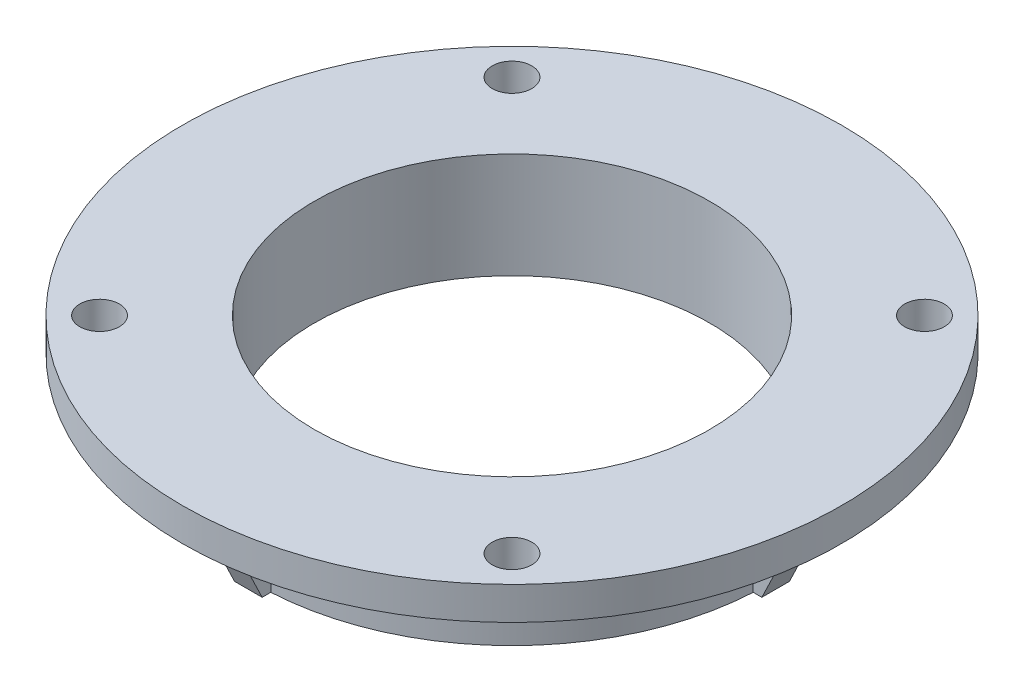
from build123d import *

# Parameters (mm, degrees)
IZIM1_R                          = 77.5
IZIM1_R_2                        = 60
IZIM1_R_3                        = 4.19
Y_KSEKLIK_EKSTR_ZYON1_DEPTH      = 10
IZIM2_R                          = 77.5
IZIM2_R_2                        = 60
Y_KSEKLIK_EKSTR_ZYON2_DEPTH      = 22
Y_KSEKLIK_EKSTR_ZYON3_START      = -10
IZIM3_R                          = 100
IZIM3_R_2                        = 60
Y_KSEKLIK_EKSTR_ZYON3_DEPTH      = 10
Y_KSEKLIK_EKSTR_ZYON4_REACH      = 210.384
Y_KSEKLIK_EKSTR_ZYON4_END_RADIUS = 77.5
IZIM5_W                          = 8.38
IZIM5_H                          = 22
DAIRESEL_KAPLAMA1_COUNT          = 4
EKSTR_ZYON_NCE4_DEPTH            = 4.19
DAIRESEL_KAPLAMA2_COUNT          = 4
IZIM7_R                          = 4.19
KES_EKSTR_ZYON1_DEPTH            = 10
IZIM8_R                          = 6
KES_EKSTR_ZYON2_DEPTH            = 144.122325303


with BuildPart() as part:
    # Çizim1 → Yükseklik-Ekstrüzyon1 (new body)
    with BuildSketch(Plane(origin=(0, 0, 0), x_dir=(1, 0, 0), z_dir=(0, 1, 0))):
        with Locations(Location((0, 0, 0), (0, 0, 270))):
            Circle(IZIM1_R)
        with Locations(Location((0, 0, 0), (0, 0, 270))):
            Circle(IZIM1_R_2, mode=Mode.SUBTRACT)
        with Locations(Location((0, 70, 0), (0, 0, 270))):
            Circle(IZIM1_R_3, mode=Mode.SUBTRACT)
        with Locations(Location((70, 0, 0), (0, 0, 270))):
            Circle(IZIM1_R_3, mode=Mode.SUBTRACT)
        with Locations(Location((0, -70, 0), (0, 0, 270))):
            Circle(IZIM1_R_3, mode=Mode.SUBTRACT)
        with Locations(Location((-70, 0, 0), (0, 0, 270))):
            Circle(IZIM1_R_3, mode=Mode.SUBTRACT)
    extrude(amount=Y_KSEKLIK_EKSTR_ZYON1_DEPTH)

    # Çizim2 → Yükseklik-Ekstrüzyon2 (add)
    with BuildSketch(Plane(origin=(0, 10, 0), x_dir=(1, 0, 0), z_dir=(0, 1, 0))):
        with Locations(Location((0, 0, 0), (0, 0, 270))):
            Circle(IZIM2_R)
        with Locations(Location((0, 0, 0), (0, 0, 270))):
            Circle(IZIM2_R_2, mode=Mode.SUBTRACT)
    extrude(amount=Y_KSEKLIK_EKSTR_ZYON2_DEPTH)

    # Çizim3 → Yükseklik-Ekstrüzyon3 (add)
    with BuildSketch(Plane(origin=(0, 32, 0), x_dir=(1, 0, 0), z_dir=(0, 1, 0)).offset(Y_KSEKLIK_EKSTR_ZYON3_START)):
        with Locations(Location((0, 0, 0), (0, 0, 270))):
            Circle(IZIM3_R)
        with Locations(Location((0, 0, 0), (0, 0, 270))):
            Circle(IZIM3_R_2, mode=Mode.SUBTRACT)
    extrude(amount=Y_KSEKLIK_EKSTR_ZYON3_DEPTH)

    # Yükseklik-Ekstrüzyon4: up to this cylinder (the profile starts outside it)
    y_kseklik_ekstr_zyon4_end = Plane(origin=(0, 11, 0), z_dir=(0, -1, 0)) * Cylinder(Y_KSEKLIK_EKSTR_ZYON4_END_RADIUS, 576.768, mode=Mode.PRIVATE)
    # Çizim5 → Yükseklik-Ekstrüzyon4 (add, up to the surface)
    with BuildSketch(Plane.XY.offset(80), mode=Mode.PRIVATE) as y_kseklik_ekstr_zyon4_sk1:
        with Locations((0, 11)):
            Rectangle(IZIM5_W, IZIM5_H)
    y_kseklik_ekstr_zyon4_tool1 = extrude(y_kseklik_ekstr_zyon4_sk1.sketch, amount=-Y_KSEKLIK_EKSTR_ZYON4_REACH, mode=Mode.PRIVATE) - y_kseklik_ekstr_zyon4_end
    y_kseklik_ekstr_zyon4 = y_kseklik_ekstr_zyon4_tool1.solids().sort_by_distance((0, 11, 80))[0]
    add(y_kseklik_ekstr_zyon4)

    # Dairesel Kaplama1: Yükseklik-Ekstrüzyon4 ×4 about axis
    dairesel_kaplama1_axis = Axis((0, 0, 0), (0, 1, 0))
    for i in range(1, DAIRESEL_KAPLAMA1_COUNT):
        add(y_kseklik_ekstr_zyon4.rotate(dairesel_kaplama1_axis, i * 360 / DAIRESEL_KAPLAMA1_COUNT))

    # Çizim6 → Ekstrüzyon-İnce4 (add, symmetric)
    with BuildSketch(Plane(origin=(0, 0, 0), x_dir=(0, 0, -1), z_dir=(1, 0, 0))):
        Polygon((-80, 0), (-90.601909395, 22), (-81.593384405, 26.341252988), (-70.99147501, 4.341252988), align=None)
    ekstr_zyon_nce4 = extrude(amount=EKSTR_ZYON_NCE4_DEPTH, both=True)

    # Dairesel Kaplama2: Ekstrüzyon-İnce4 ×4 about axis
    dairesel_kaplama2_axis = Axis((0, 0, 0), (0, 1, 0))
    for i in range(1, DAIRESEL_KAPLAMA2_COUNT):
        add(ekstr_zyon_nce4.rotate(dairesel_kaplama2_axis, i * 360 / DAIRESEL_KAPLAMA2_COUNT))

    # Çizim7 → Kes-Ekstrüzyon1 (cut)
    with BuildSketch(Plane.XZ):
        with Locations(Location((70, 0, 0), (0, 0, 90))):
            Circle(IZIM7_R)
        with Locations(Location((0, -70, 0), (0, 0, 90))):
            Circle(IZIM7_R)
        with Locations(Location((-70, 0, 0), (0, 0, 90))):
            Circle(IZIM7_R)
        with Locations(Location((0, 70, 0), (0, 0, 90))):
            Circle(IZIM7_R)
    extrude(amount=-KES_EKSTR_ZYON1_DEPTH, mode=Mode.SUBTRACT)

    # Çizim8 → Kes-Ekstrüzyon2 (cut, through all)
    with BuildSketch(Plane.XZ.offset(-22)):
        with Locations(Location((62.578950135, -62.578950135, 0), (0, 0, 270))):
            Circle(IZIM8_R)
        with Locations(Location((-62.578950135, -62.578950135, 0), (0, 0, 270))):
            Circle(IZIM8_R)
        with Locations(Location((-62.578950135, 62.578950135, 0), (0, 0, 270))):
            Circle(IZIM8_R)
        with Locations(Location((62.578950135, 62.578950135, 0), (0, 0, 270))):
            Circle(IZIM8_R)
    extrude(amount=-KES_EKSTR_ZYON2_DEPTH, mode=Mode.SUBTRACT)


solid = part.part
